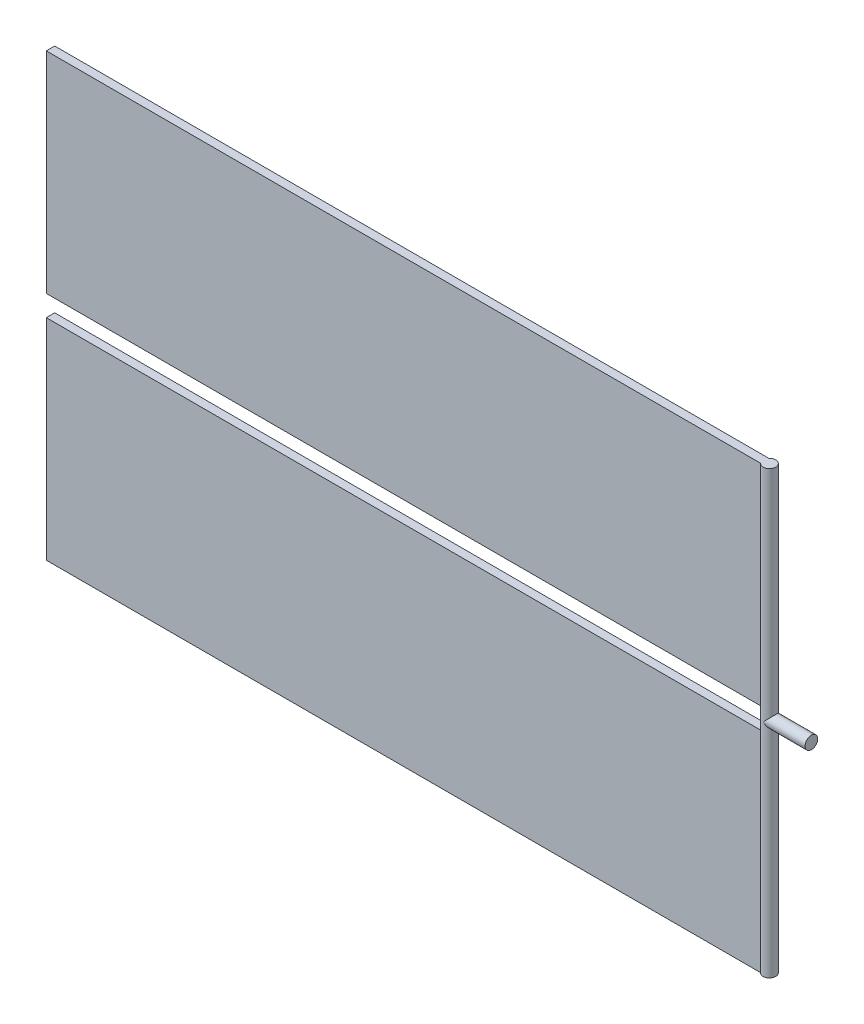
from build123d import *

# Parameters (mm, degrees)
BOSS_EXTRUDE1_DEPTH        = 100
BOSS_EXTRUDE1_DEPTH_BACK   = 100
SKETCH2_W                  = 17000
SKETCH2_H                  = 5000
BOSS_EXTRUDE1_2_DEPTH      = 100
BOSS_EXTRUDE1_2_DEPTH_BACK = 100
BOSS_EXTRUDE2_DEPTH        = 5250
BOSS_EXTRUDE2_DEPTH_BACK   = 5250
BOSS_EXTRUDE3_START        = 111.76
SKETCH5_R                  = 150
BOSS_EXTRUDE3_DEPTH        = 1000


with BuildPart() as part:
    # Sketch2 → Boss-Extrude1 (new, two sides: drawn at the far end of the back side and taken through both)
    with BuildSketch(Plane.XY.offset(-BOSS_EXTRUDE1_DEPTH_BACK)):
        with Locations((-8500, -2750)):
            Rectangle(SKETCH2_W, SKETCH2_H)
    extrude(amount=BOSS_EXTRUDE1_DEPTH + BOSS_EXTRUDE1_DEPTH_BACK)



with BuildPart() as body_2:
    # Sketch2 → Boss-Extrude1 2 (new, two sides: drawn at the far end of the back side and taken through both)
    with BuildSketch(Plane.XY.offset(-BOSS_EXTRUDE1_2_DEPTH_BACK)):
        with Locations((-8500, 2750)):
            Rectangle(SKETCH2_W, SKETCH2_H)
    extrude(amount=BOSS_EXTRUDE1_2_DEPTH + BOSS_EXTRUDE1_2_DEPTH_BACK)


with BuildPart() as part_1:
    add(part.part)

    add(body_2.part)  # Boss-Extrude2 merges body 2
    # Sketch4 → Boss-Extrude2 (add, two sides: drawn at the far end of the back side and taken through both)
    with BuildSketch(Plane(origin=(0, 0, 0), x_dir=(1, 0, 0), z_dir=(0, 1, 0)).offset(-BOSS_EXTRUDE2_DEPTH_BACK)):
        with BuildLine():
            Line((0, 100), (0, -100))
            ThreePointArc((0, -100), (261.803398875, 0), (0, 100))
        make_face()
    extrude(amount=BOSS_EXTRUDE2_DEPTH + BOSS_EXTRUDE2_DEPTH_BACK)

    # Sketch5 → Boss-Extrude3 (add)
    with BuildSketch(Plane(origin=(0, 0, 0), x_dir=(0, 0, -1), z_dir=(1, 0, 0)).offset(BOSS_EXTRUDE3_START)):
        Circle(SKETCH5_R)
    extrude(amount=BOSS_EXTRUDE3_DEPTH)


solid = part_1.part
